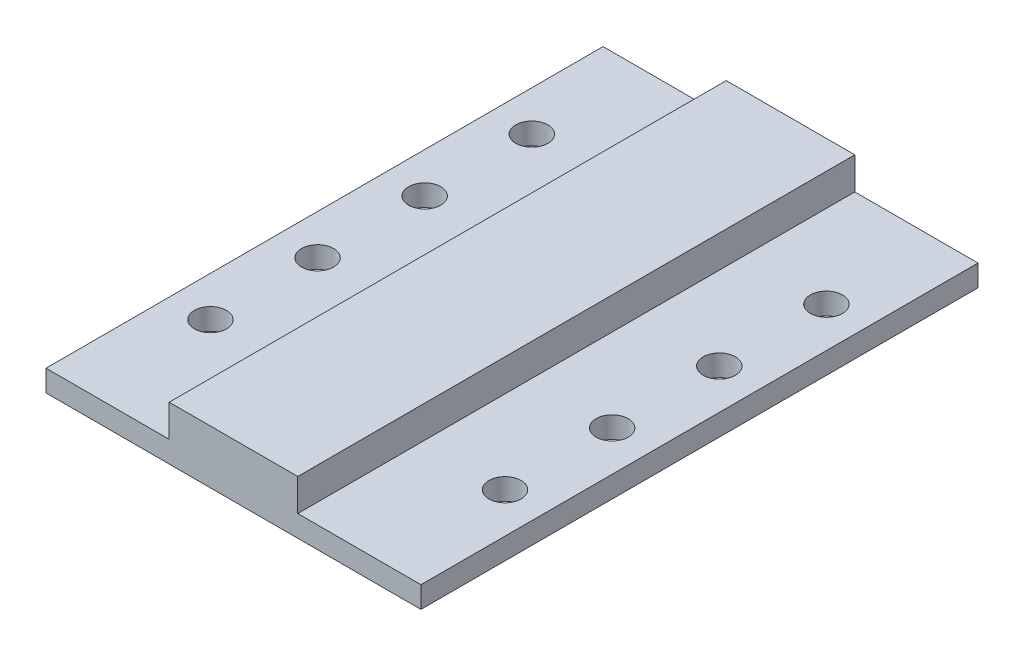
from build123d import *

# Parameters (mm, degrees)
SKETCH_1_W                  = 35
SKETCH_1_H                  = 52
EXTRUDE_1_DEPTH             = 2
EXTRUDE_2_REACH             = 33.405
SKETCH_2_W                  = 12
SKETCH_2_H                  = 3
EXTRUDE_2_DIRECTION_2_REACH = 33.405
SKETCH_3_R                  = 1.5
CUT_EXTRUDE_1_DEPTH         = 10


with BuildPart() as part:
    # Эскиз1 → Бобышка-Вытянуть1 (new body)
    with BuildSketch(Plane(origin=(0, 0, 0), x_dir=(1, 0, 0), z_dir=(0, 1, 0))):
        Rectangle(SKETCH_1_W, SKETCH_1_H)
    extrude(amount=EXTRUDE_1_DEPTH)

    # Бобышка-Вытянуть2: up to this face of the body (flat: up to its plane)
    extrude_2_end = Plane(part.part.faces().sort_by_distance((0, 1, 26))[0])
    # Эскиз2 → Бобышка-Вытянуть2 (add, up to the picked face)
    with BuildSketch(Plane.XY, mode=Mode.PRIVATE) as extrude_2_sk1:
        with Locations((0, 3.5)):
            Rectangle(SKETCH_2_W, SKETCH_2_H)
    extrude_2_tool1 = split(extrude(extrude_2_sk1.sketch, amount=EXTRUDE_2_REACH, mode=Mode.PRIVATE), bisect_by=extrude_2_end, keep=Keep.BOTH, mode=Mode.PRIVATE)
    add(extrude_2_tool1.solids().sort_by(Axis((0, 3.5, 0), (0, 0, 1)))[0])

    # Бобышка-Вытянуть2 direction 2: up to this face of the body (flat: up to its plane)
    extrude_2_direction_2_end = Plane(part.part.faces().sort_by_distance((0, 1, -26))[0])
    # Эскиз2 → Бобышка-Вытянуть2 direction 2 (add, up to the picked face)
    with BuildSketch(Plane.XY, mode=Mode.PRIVATE) as extrude_2_direction_2_sk1:
        with Locations((0, 3.5)):
            Rectangle(SKETCH_2_W, SKETCH_2_H)
    extrude_2_direction_2_tool1 = split(extrude(extrude_2_direction_2_sk1.sketch, amount=-EXTRUDE_2_DIRECTION_2_REACH, mode=Mode.PRIVATE), bisect_by=extrude_2_direction_2_end, keep=Keep.BOTH, mode=Mode.PRIVATE)
    add(extrude_2_direction_2_tool1.solids().sort_by(Axis((0, 3.5, 0), (0, 0, -1)))[0])

    # Эскиз3 → Вырез-Вытянуть1 (cut)
    with BuildSketch(Plane(origin=(0, 2, 0), x_dir=(1, 0, 0), z_dir=(0, 1, 0))):
        with Locations(Location((13.75, 15.6, 0), (0, 0, 270))):
            Circle(SKETCH_3_R)
        with Locations(Location((-13.75, 15.6, 0), (0, 0, 270))):
            Circle(SKETCH_3_R)
        with Locations(Location((-13.75, 5.6, 0), (0, 0, 270))):
            Circle(SKETCH_3_R)
        with Locations(Location((13.75, 5.6, 0), (0, 0, 270))):
            Circle(SKETCH_3_R)
        with Locations(Location((-13.75, -4.4, 0), (0, 0, 270))):
            Circle(SKETCH_3_R)
        with Locations(Location((13.75, -4.4, 0), (0, 0, 270))):
            Circle(SKETCH_3_R)
        with Locations(Location((-13.75, -14.4, 0), (0, 0, 270))):
            Circle(SKETCH_3_R)
        with Locations(Location((13.75, -14.4, 0), (0, 0, 270))):
            Circle(SKETCH_3_R)
    extrude(amount=-CUT_EXTRUDE_1_DEPTH, mode=Mode.SUBTRACT)


solid = part.part
